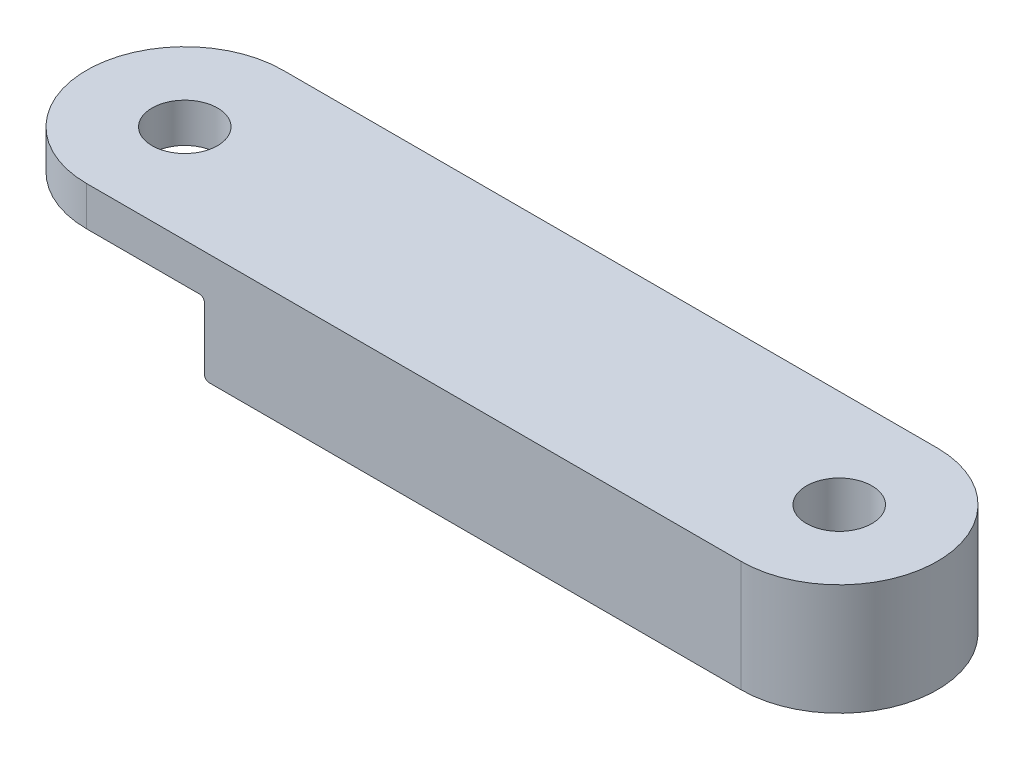
from build123d import *

# Parameters (mm, degrees)
SKETCH1_R           = 2.4
BOSS_EXTRUDE1_DEPTH = 15
SKETCH2_R           = 2.4
CUT_EXTRUDE1_DEPTH  = 12
SKETCH3_W           = 81.763751064
SKETCH3_H           = 26.290001284
CUT_EXTRUDE2_DEPTH  = 5
SCALE1_SCALE        = 0.8
SKETCH4_R           = 2
CUT_EXTRUDE3_DEPTH  = 52.087489074
SKETCH5_W           = 42.014746782
SKETCH5_H           = 19.111045429
CUT_EXTRUDE4_DEPTH  = 1.2
FILLET1_R           = 0.3
FILLET3_R           = 0.3


with BuildPart() as part:
    # Sketch1 → Boss-Extrude1 (new body)
    with BuildSketch(Plane(origin=(0, 0, 0), x_dir=(1, 0, 0), z_dir=(0, 1, 0))):
        with BuildLine():
            Line((-50, 7.5), (0, 7.5))
            ThreePointArc((0, 7.5), (7.5, 0), (0, -7.5))
            Line((0, -7.5), (-50, -7.5))
            ThreePointArc((-50, -7.5), (-57.5, 0), (-50, 7.5))
        make_face()
        with Locations(Location((-50, 0, 0), (0, 0, 270))):
            Circle(SKETCH1_R, mode=Mode.SUBTRACT)
        with Locations(Location((0, 0, 0), (0, 0, 270))):
            Circle(SKETCH1_R, mode=Mode.SUBTRACT)
    extrude(amount=BOSS_EXTRUDE1_DEPTH)

    # Sketch2 → Cut-Extrude1 (cut)
    with BuildSketch(Plane(origin=(0, 0, 0), x_dir=(1, 0, 0), z_dir=(0, 1, 0))):
        with BuildLine():
            Line((-50, 7.5), (-41, 7.5))
            Line((-41, 7.5), (-41, -7.5))
            Line((-41, -7.5), (-50, -7.5))
            ThreePointArc((-50, -7.5), (-57.5, 0), (-50, 7.5))
        make_face()
        with Locations(Location((-50, 0, 0), (0, 0, 270))):
            Circle(SKETCH2_R, mode=Mode.SUBTRACT)
    extrude(amount=CUT_EXTRUDE1_DEPTH, mode=Mode.SUBTRACT)

    # Sketch3 → Cut-Extrude2 (cut)
    with BuildSketch(Plane.XZ):
        with Locations((-24.1072482, 0)):
            Rectangle(SKETCH3_W, SKETCH3_H)
    extrude(amount=-CUT_EXTRUDE2_DEPTH, mode=Mode.SUBTRACT)


with BuildPart() as part_1:
    # Scale1: scaled about (-20.496084793, 10.28858221, 0)
    add(part.part.scale(SCALE1_SCALE).moved(Location((-4.099216959, 2.057716442, 0))))

    # Sketch4 → Cut-Extrude3 (cut, through all)
    with BuildSketch(Plane(origin=(0, 14.057716442, 0), x_dir=(1, 0, 0), z_dir=(0, 1, 0))):
        with Locations(Location((-44.099216959, 0, 0), (0, 0, 270))):
            Circle(SKETCH4_R)
        with Locations(Location((-4.099216959, 0, 0), (0, 0, 270))):
            Circle(SKETCH4_R)
    extrude(amount=-CUT_EXTRUDE3_DEPTH, mode=Mode.SUBTRACT)

    # Sketch5 → Cut-Extrude4 (cut)
    with BuildSketch(Plane.XZ.offset(-6.057716442)):
        with Locations((-17.942307993, -0.717456632)):
            Rectangle(SKETCH5_W, SKETCH5_H)
    extrude(amount=-CUT_EXTRUDE4_DEPTH, mode=Mode.SUBTRACT)

    # Fillet1
    fillet1_edges = [part_1.edges().sort_by_distance(p)[0] for p in [
        (-36.899216959, 11.657716442, 0),
    ]]
    fillet(fillet1_edges, radius=FILLET1_R)

    # Fillet3
    fillet3_edges = [part_1.edges().sort_by_distance(p)[0] for p in [
        (-36.899216959, 7.257716442, 0),
    ]]
    fillet(fillet3_edges, radius=FILLET3_R)


solid = part_1.part
